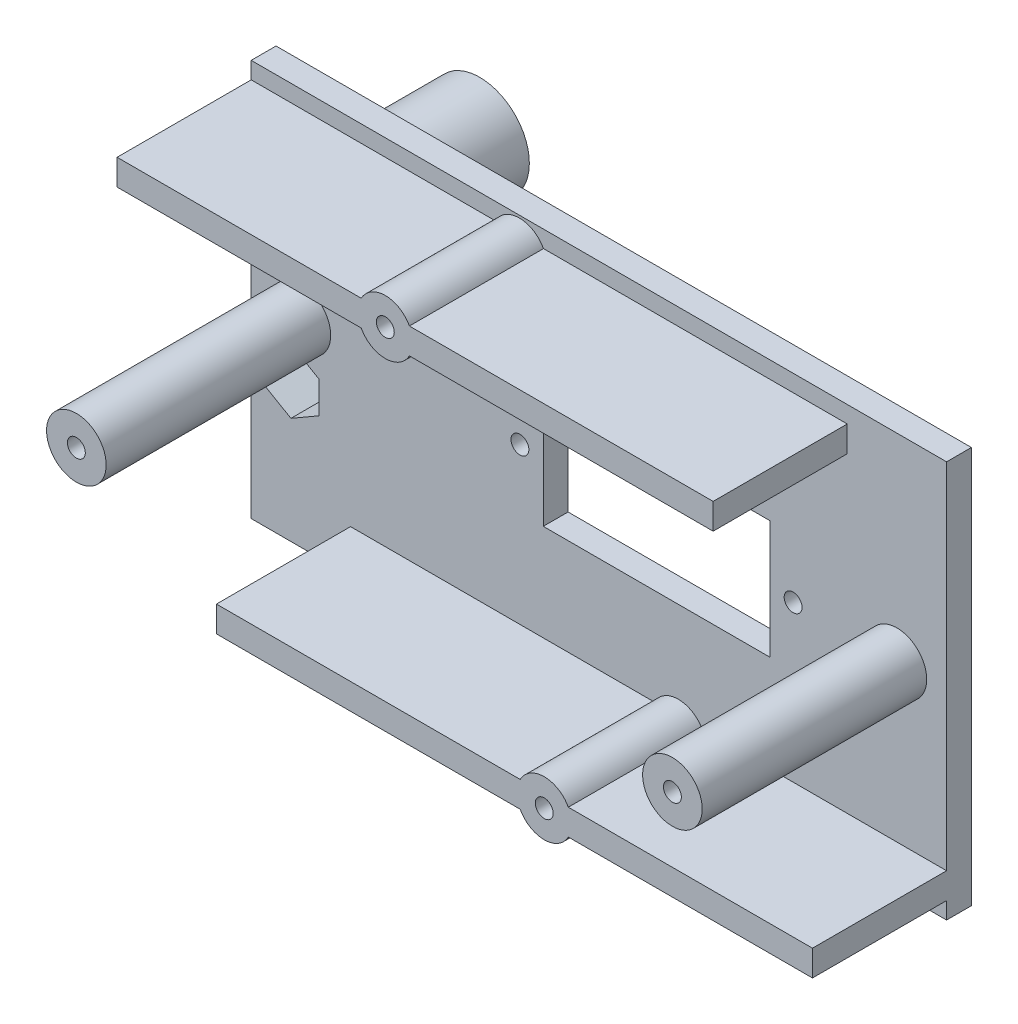
from build123d import *

# Parameters (mm, degrees)
BOSS_EXTRUDE1_START     = -2.5
SKETCH1_W               = 70
SKETCH1_H               = 39.95
BOSS_EXTRUDE1_DEPTH     = 2.5
SKETCH2_W               = 60
SKETCH2_H               = 2.6
BOSS_EXTRUDE2_DEPTH     = 13.5
SKETCH3_W               = 60
SKETCH3_H               = 2.6
BOSS_EXTRUDE3_DEPTH     = 13.5
SKETCH4_R               = 2.75
BOSS_EXTRUDE4_DEPTH     = 13.5
BOSS_EXTRUDE5_START     = -19
SKETCH5_R               = 5
BOSS_EXTRUDE5_DEPTH     = 16.5
SKETCH6_R               = 3
BOSS_EXTRUDE6_DEPTH     = 22.6
CUT_EXTRUDE1_START      = 14.6
SKETCH7_R               = 0.9
CUT_EXTRUDE1_DEPTH      = 8.1
CUT_EXTRUDE2_DEPTH      = 47.965525921
CUT_EXTRUDE2_DEPTH_BACK = 47.965525921
SKETCH8_W               = 22.8
SKETCH8_H               = 11.9
CUT_EXTRUDE3_DEPTH      = 47.965525921
CUT_EXTRUDE3_DEPTH_BACK = 47.965525921
SKETCH9_R               = 0.9
CUT_EXTRUDE4_DEPTH      = 47.965525921
CUT_EXTRUDE4_DEPTH_BACK = 47.965525921
SKETCH10_R              = 0.9
CUT_EXTRUDE5_DEPTH      = 47.965525921
CUT_EXTRUDE5_DEPTH_BACK = 47.965525921
SKETCH11_R              = 1.725
CUT_EXTRUDE6_START      = -4.2
CUT_EXTRUDE6_DEPTH      = 4.2


with BuildPart() as part:
    # Sketch1 → Boss-Extrude1 (new body)
    with BuildSketch(Plane.XY.offset(BOSS_EXTRUDE1_START)):
        Rectangle(SKETCH1_W, SKETCH1_H)
    extrude(amount=BOSS_EXTRUDE1_DEPTH)

    # Sketch2 → Boss-Extrude2 (add)
    with BuildSketch(Plane.XY):
        with Locations((-5, 16.975)):
            Rectangle(SKETCH2_W, SKETCH2_H)
    extrude(amount=BOSS_EXTRUDE2_DEPTH)

    # Sketch3 → Boss-Extrude3 (add)
    with BuildSketch(Plane.XY):
        with Locations((5, -16.975)):
            Rectangle(SKETCH3_W, SKETCH3_H)
    extrude(amount=BOSS_EXTRUDE3_DEPTH)

    # Sketch4 → Boss-Extrude4 (add)
    with BuildSketch(Plane.XY):
        with Locations((-8, 16.975)):
            Circle(SKETCH4_R)
        with Locations((8, -16.975)):
            Circle(SKETCH4_R)
    extrude(amount=BOSS_EXTRUDE4_DEPTH)

    # Sketch5 → Boss-Extrude5 (add)
    with BuildSketch(Plane.XY.offset(BOSS_EXTRUDE5_START)):
        with Locations(Location((-31, 6, 0), (0, 0, 143.130102354))):
            Circle(SKETCH5_R)
        with Locations(Location((-31, -6, 0), (0, 0, 143.130102354))):
            Circle(SKETCH5_R)
    extrude(amount=BOSS_EXTRUDE5_DEPTH)

    # Sketch6 → Boss-Extrude6 (add)
    with BuildSketch(Plane.XY):
        with Locations((30, 0)):
            Circle(SKETCH6_R)
        with Locations((-30, 0)):
            Circle(SKETCH6_R)
    extrude(amount=BOSS_EXTRUDE6_DEPTH)

    # Sketch7 → Cut-Extrude1 (cut)
    with BuildSketch(Plane.XY.offset(CUT_EXTRUDE1_START)):
        with Locations((30, 0)):
            Circle(SKETCH7_R)
        with Locations((-30, 0)):
            Circle(SKETCH7_R)
    extrude(amount=CUT_EXTRUDE1_DEPTH, mode=Mode.SUBTRACT)

    # Sketch8 → Cut-Extrude2 (cut, two sides: drawn at the far end of the back side and taken through both)
    with BuildSketch(Plane.XY.offset(-CUT_EXTRUDE2_DEPTH_BACK)):
        with Locations((5.8, 0)):
            Rectangle(SKETCH8_W, SKETCH8_H)
    extrude(amount=CUT_EXTRUDE2_DEPTH + CUT_EXTRUDE2_DEPTH_BACK, mode=Mode.SUBTRACT)

    # Sketch9 → Cut-Extrude3 (cut, two sides: drawn at the far end of the back side and taken through both)
    with BuildSketch(Plane.XY.offset(-CUT_EXTRUDE3_DEPTH_BACK)):
        with Locations((-7.95, 0)):
            Circle(SKETCH9_R)
        with Locations((19.55, 0)):
            Circle(SKETCH9_R)
    extrude(amount=CUT_EXTRUDE3_DEPTH + CUT_EXTRUDE3_DEPTH_BACK, mode=Mode.SUBTRACT)

    # Sketch10 → Cut-Extrude4 (cut, two sides: drawn at the far end of the back side and taken through both)
    with BuildSketch(Plane.XY.offset(-CUT_EXTRUDE4_DEPTH_BACK)):
        with Locations((-8, 16.975)):
            Circle(SKETCH10_R)
        with Locations((8, -16.975)):
            Circle(SKETCH10_R)
    extrude(amount=CUT_EXTRUDE4_DEPTH + CUT_EXTRUDE4_DEPTH_BACK, mode=Mode.SUBTRACT)

    # Sketch11 → Cut-Extrude5 (cut, two sides: drawn at the far end of the back side and taken through both)
    with BuildSketch(Plane.XY.offset(-CUT_EXTRUDE5_DEPTH_BACK)):
        with Locations((-31, 6)):
            Circle(SKETCH11_R)
        with Locations((-31, -6)):
            Circle(SKETCH11_R)
    extrude(amount=CUT_EXTRUDE5_DEPTH + CUT_EXTRUDE5_DEPTH_BACK, mode=Mode.SUBTRACT)

    # Sketch12 → Cut-Extrude6 (cut)
    with BuildSketch(Plane.XY.offset(CUT_EXTRUDE6_START)):
        Polygon((-28.2, 7.616580754), (-31, 9.233161507), (-33.8, 7.616580754), (-33.8, 4.383419246), (-31, 2.766838493), (-28.2, 4.383419246), align=None)
        Polygon((-28.2, -4.383419246), (-31, -2.766838493), (-33.8, -4.383419246), (-33.8, -7.616580754), (-31, -9.233161507), (-28.2, -7.616580754), align=None)
    extrude(amount=CUT_EXTRUDE6_DEPTH, mode=Mode.SUBTRACT)


solid = part.part
